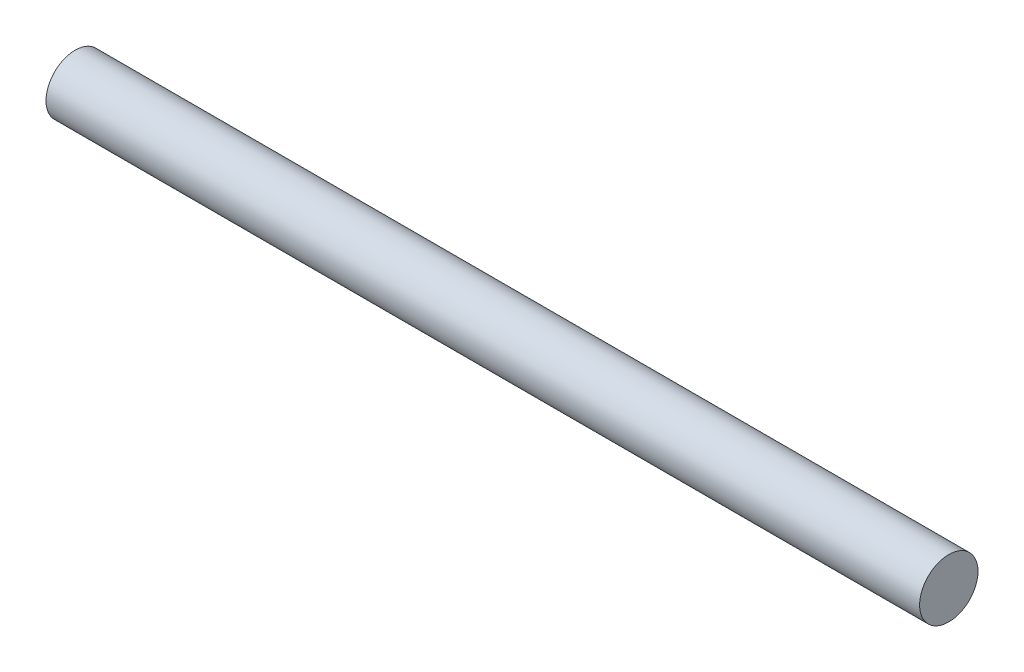
from build123d import *

# Parameters (mm, degrees)
BOSS_EXTRUDE1_DEPTH      = 175
BOSS_EXTRUDE1_DEPTH_BACK = 175
SKETCH1_R                = 12.7
SKETCH2_R                = 12.7
BOSS_EXTRUDE2_DEPTH      = 15
BOSS_EXTRUDE3_START      = 15
SKETCH3_R                = 12.7
BOSS_EXTRUDE3_DEPTH      = 15


with BuildPart() as part:
    # Sketch1 → Boss-Extrude1 (new, two sides: drawn at the far end of the back side and taken through both)
    with BuildSketch(Plane(origin=(0, 0, 0), x_dir=(0, 0, -1), z_dir=(1, 0, 0)).offset(-BOSS_EXTRUDE1_DEPTH_BACK)):
        Circle(SKETCH1_R)
    extrude(amount=BOSS_EXTRUDE1_DEPTH + BOSS_EXTRUDE1_DEPTH_BACK)

    # Sketch2 → Boss-Extrude2 (add)
    with BuildSketch(Plane(origin=(175, 0, 0), x_dir=(0, 0, -1), z_dir=(1, 0, 0))):
        Circle(SKETCH2_R)
    extrude(amount=BOSS_EXTRUDE2_DEPTH)

    # Sketch3 → Boss-Extrude3 (add)
    with BuildSketch(Plane.ZY.offset(175).offset(BOSS_EXTRUDE3_START)):
        Circle(SKETCH3_R)
    extrude(amount=-BOSS_EXTRUDE3_DEPTH)


solid = part.part
